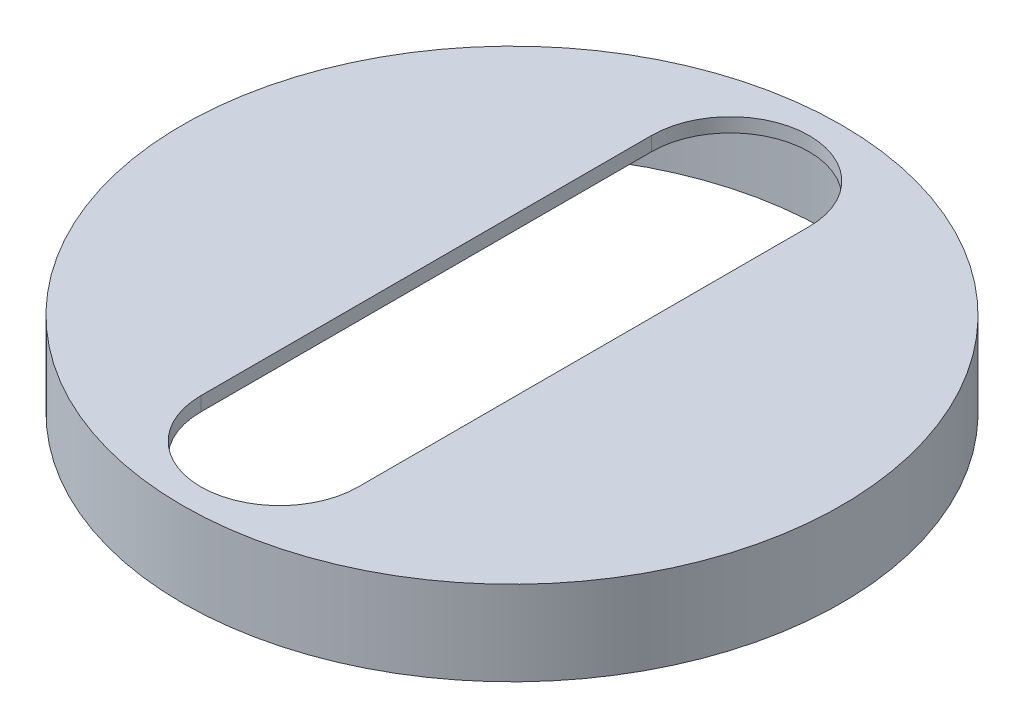
from build123d import *

# Parameters (mm, degrees)
SKETCH1_R           = 234
SKETCH1_R_2         = 224
BOSS_EXTRUDE1_DEPTH = 60
SKETCH1_3_R         = 224
BOSS_EXTRUDE2_DEPTH = 10


with BuildPart() as part:
    # Sketch1 → Boss-Extrude1 (new body)
    with BuildSketch(Plane(origin=(0, 0, 0), x_dir=(1, 0, 0), z_dir=(0, 1, 0))):
        Circle(SKETCH1_R)
        Circle(SKETCH1_R_2, mode=Mode.SUBTRACT)
    extrude(amount=-BOSS_EXTRUDE1_DEPTH)

    # Sketch1<3> → Boss-Extrude2 (add)
    with BuildSketch(Plane(origin=(0, 0, 0), x_dir=(1, 0, 0), z_dir=(0, 1, 0))):
        Circle(SKETCH1_3_R)
        with BuildLine():
            ThreePointArc((-61, 160), (-5, 216), (51, 160))
            Line((51, 160), (51, -160))
            ThreePointArc((51, -160), (-5, -216), (-61, -160))
            Line((-61, -160), (-61, 160))
        make_face(mode=Mode.SUBTRACT)
    extrude(amount=-BOSS_EXTRUDE2_DEPTH)


solid = part.part
